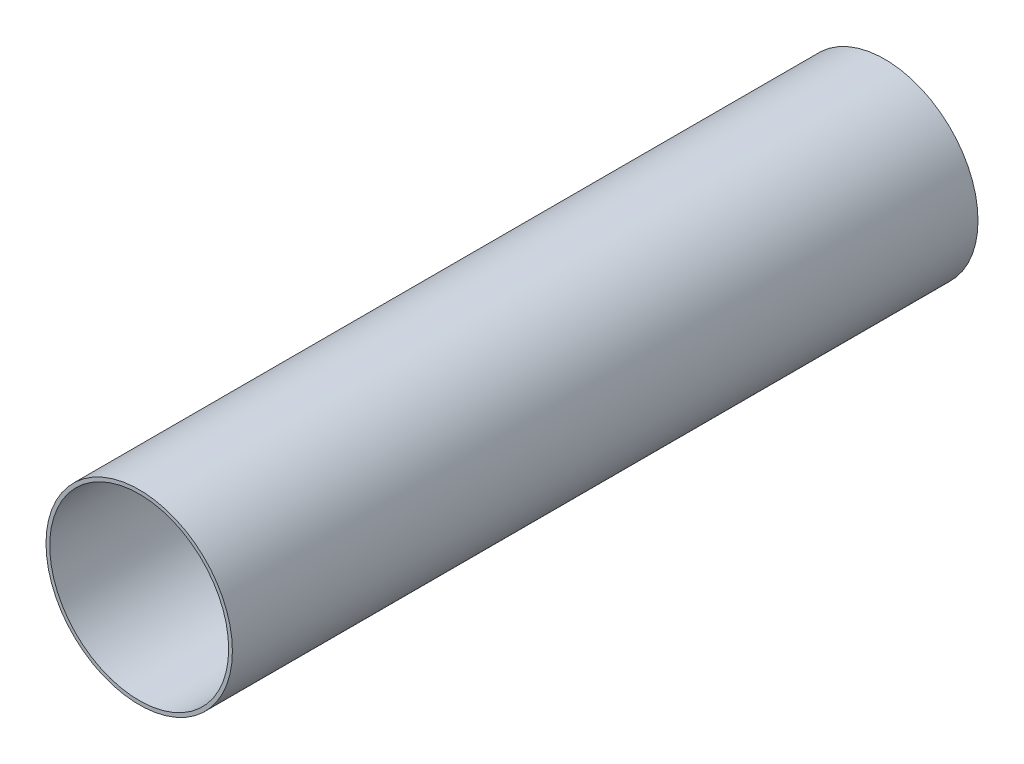
from build123d import *

# Parameters (mm, degrees)
ESQUISSE1_R        = 25
ESQUISSE1_R_2      = 24
EXTRU_MINCE1_DEPTH = 200


with BuildPart() as part:
    # Esquisse1 → Extru.-Mince1 (new body)
    with BuildSketch(Plane.XY):
        Circle(ESQUISSE1_R)
        Circle(ESQUISSE1_R_2, mode=Mode.SUBTRACT)
    extrude(amount=EXTRU_MINCE1_DEPTH)


solid = part.part
